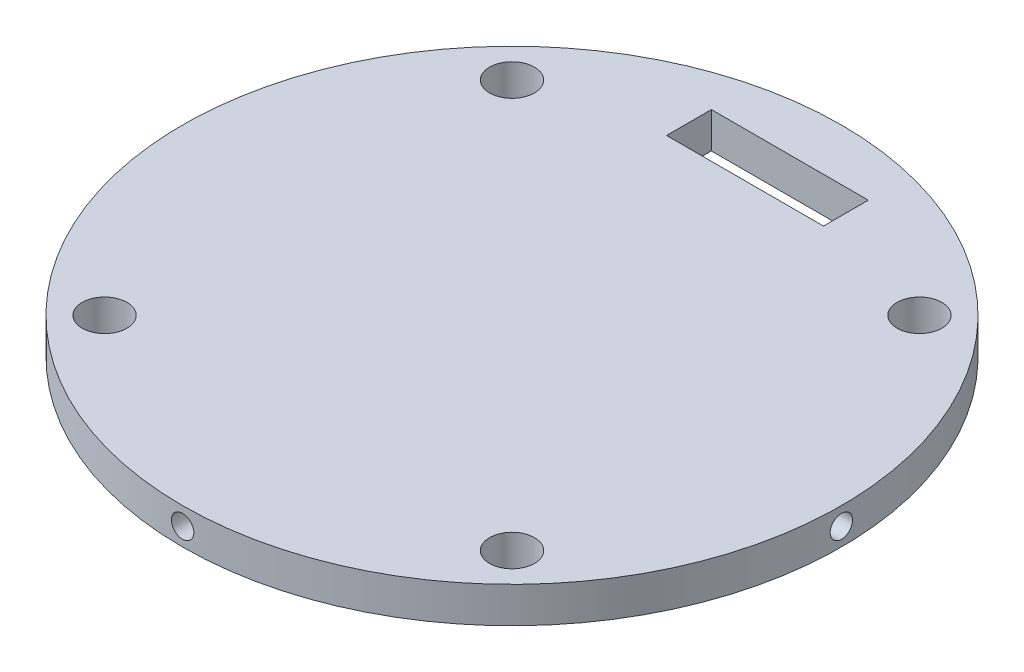
from build123d import *

# Parameters (mm, degrees)
SKETCH_1_R          = 73.5
SKETCH_1_R_2        = 5
SKETCH_1_W          = 35
SKETCH_1_H          = 10
EXTRUDE_1_DEPTH     = 8
CUT_EXTRUDE_1_DEPTH = 8
CUT_EXTRUDE_3_DEPTH = 8


with BuildPart() as part:
    # 草图1 → 凸台-拉伸1 (new body)
    with BuildSketch(Plane(origin=(0, 0, 0), x_dir=(1, 0, 0), z_dir=(0, 1, 0))):
        with Locations(Location((0, 0, 0), (0, 0, 270))):
            Circle(SKETCH_1_R)
        with Locations(Location((-45.437321384, 45.437321385, 0), (0, 0, 270))):
            Circle(SKETCH_1_R_2, mode=Mode.SUBTRACT)
        with Locations(Location((-45.437321384, -45.437321385, 0), (0, 0, 90))):
            Circle(SKETCH_1_R_2, mode=Mode.SUBTRACT)
        with Locations(Location((45.437321384, 45.437321385, 0), (0, 0, 90))):
            Circle(SKETCH_1_R_2, mode=Mode.SUBTRACT)
        with Locations(Location((45.437321384, -45.437321385, 0), (0, 0, 270))):
            Circle(SKETCH_1_R_2, mode=Mode.SUBTRACT)
        with Locations((0, 56.967179039)):
            Rectangle(SKETCH_1_W, SKETCH_1_H, mode=Mode.SUBTRACT)
    extrude(amount=EXTRUDE_1_DEPTH)

    # 草图2 → 切除-拉伸1 (cut)
    with BuildSketch(Plane.XY.offset(73.5)):
        with BuildLine():
            ThreePointArc((0, 6.5), (-2.5, 4), (0, 1.5))
            Line((0, 1.5), (0, 6.5))
        make_face()
        with BuildLine():
            Line((0, 6.5), (0, 1.5))
            ThreePointArc((0, 1.5), (1.767766953, 2.232233047), (2.5, 4))
            ThreePointArc((2.5, 4), (1.767766953, 5.767766953), (0, 6.5))
        make_face()
    cut_extrude_1 = extrude(amount=-CUT_EXTRUDE_1_DEPTH, mode=Mode.SUBTRACT)

    # 镜向1: 切除-拉伸1 across plane
    add(cut_extrude_1.mirror(Plane.XY), mode=Mode.SUBTRACT)

    # 草图3 → 切除-拉伸3 (cut)
    with BuildSketch(Plane(origin=(73.5, 0, 0), x_dir=(0, 0, -1), z_dir=(1, 0, 0))):
        with BuildLine():
            ThreePointArc((0, 6.5), (-2.5, 4), (0, 1.5))
            Line((0, 1.5), (0, 6.5))
        make_face()
        with BuildLine():
            Line((0, 6.5), (0, 1.5))
            ThreePointArc((0, 1.5), (1.767766953, 2.232233047), (2.5, 4))
            ThreePointArc((2.5, 4), (1.767766953, 5.767766953), (0, 6.5))
        make_face()
    cut_extrude_3 = extrude(amount=-CUT_EXTRUDE_3_DEPTH, mode=Mode.SUBTRACT)

    # 镜向2: 切除-拉伸3 across plane
    add(cut_extrude_3.mirror(Plane(origin=(0, 0, 0), x_dir=(0, 0, 1), z_dir=(1, 0, 0))), mode=Mode.SUBTRACT)


solid = part.part
